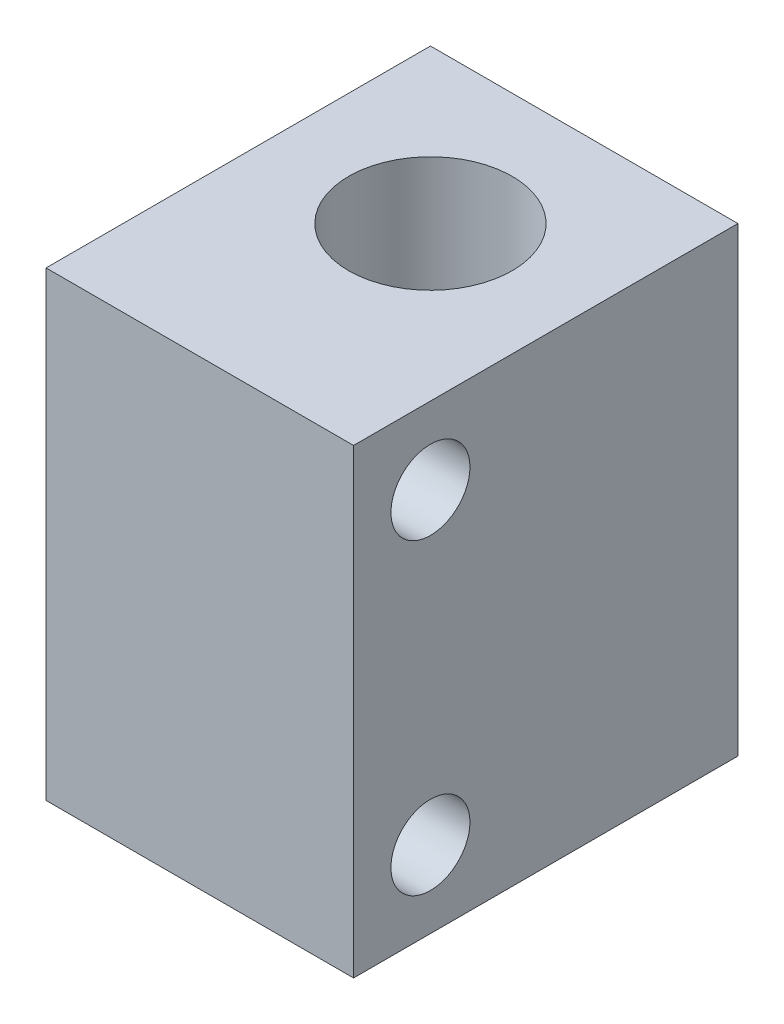
from build123d import *

# Parameters (mm, degrees)
SKETCH1_W               = 12.7
SKETCH1_H               = 19.05
BOSS_EXTRUDE1_DEPTH     = 15.875
F_1_4_CLEARANCE_HOLE1_D = 6.7564
F_4_CLEARANCE_HOLE1_D   = 3.2639


with BuildPart() as part:
    # Sketch1 → Boss-Extrude1 (new body)
    with BuildSketch(Plane.XY):
        Rectangle(SKETCH1_W, SKETCH1_H)
    extrude(amount=BOSS_EXTRUDE1_DEPTH)

    # 1/4 Clearance Hole1 (through all)
    with Locations(Plane(origin=(0, 9.525, 0), x_dir=(1, 0, 0), z_dir=(0, 1, 0))):
        with Locations((0, -6.35)):
            Hole(F_1_4_CLEARANCE_HOLE1_D / 2)

    # #4 Clearance Hole1 (through all)
    with Locations(Plane(origin=(6.35, 0, 0), x_dir=(0, 0, -1), z_dir=(1, 0, 0))):
        with Locations((-12.7, 6.35), (-12.7, -6.35)):
            Hole(F_4_CLEARANCE_HOLE1_D / 2)


solid = part.part
